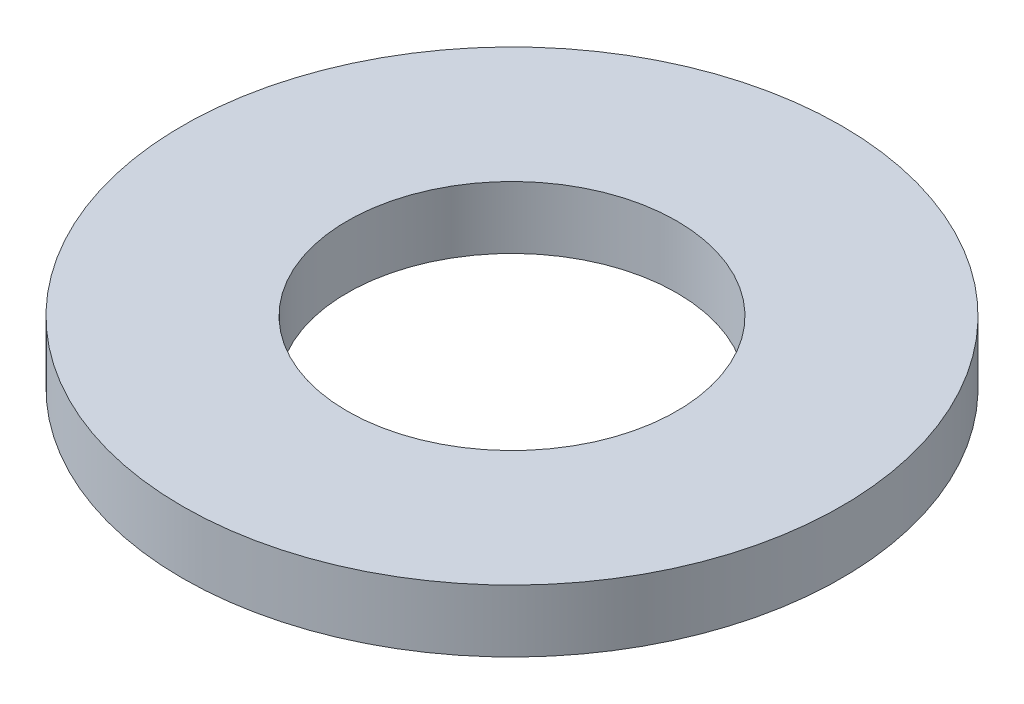
from build123d import *

# Parameters (mm, degrees)
SKETCH1_R           = 8.73125
SKETCH1_R_2         = 4.365625
BOSS_EXTRUDE1_DEPTH = 1.651


with BuildPart() as part:
    # Sketch1 → Boss-Extrude1 (new body)
    with BuildSketch(Plane.XZ):
        with Locations((-47.114286423, -64.551763535)):
            Circle(SKETCH1_R)
        with Locations((-47.114286423, -64.551763535)):
            Circle(SKETCH1_R_2, mode=Mode.SUBTRACT)
    extrude(amount=-BOSS_EXTRUDE1_DEPTH)


solid = part.part
